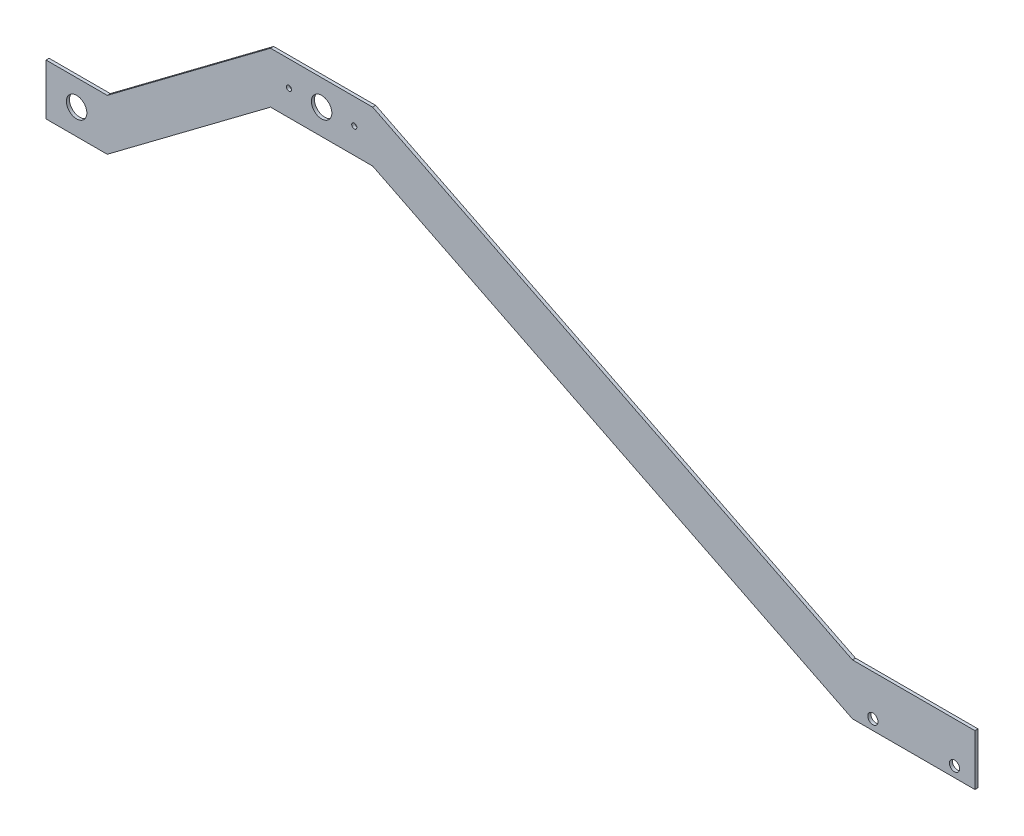
from build123d import *

# Parameters (mm, degrees)
BOSS_EXTRUDE3_DEPTH = 3
SKETCH3_R           = 10
SKETCH3_R_2         = 5
CUT_EXTRUDE1_DEPTH  = 889.569461306
SKETCH4_R           = 2.5
CUT_EXTRUDE2_DEPTH  = 10


with BuildPart() as part:
    # Sketch1 → Boss-Extrude3 (new body)
    with BuildSketch(Plane.XY):
        Polygon((60, 25), (-60, 25), (-530, 258.933751306), (-630, 258.933751306), (-790, 138.933751306), (-850, 138.933751306), (-850, 88.933751306), (-790, 88.933751306), (-630, 208.933751306), (-530, 208.933751306), (-60, -25), (60, -25), align=None)
    extrude(amount=BOSS_EXTRUDE3_DEPTH)

    # Sketch3 → Cut-Extrude1 (cut, through all)
    with BuildSketch(Plane.XY.offset(3)):
        with Locations((-580, 233.933751306)):
            Circle(SKETCH3_R)
        with Locations((-820, 113.933751306)):
            Circle(SKETCH3_R)
        with Locations((40, -15)):
            Circle(SKETCH3_R_2)
        with Locations((-40, -15)):
            Circle(SKETCH3_R_2)
    extrude(amount=-CUT_EXTRUDE1_DEPTH, mode=Mode.SUBTRACT)

    # Sketch4 → Cut-Extrude2 (cut)
    with BuildSketch(Plane.XY.offset(3)):
        with Locations((-548, 233.933751306)):
            Circle(SKETCH4_R)
        with Locations((-612, 233.933751306)):
            Circle(SKETCH4_R)
    extrude(amount=-CUT_EXTRUDE2_DEPTH, mode=Mode.SUBTRACT)


solid = part.part
